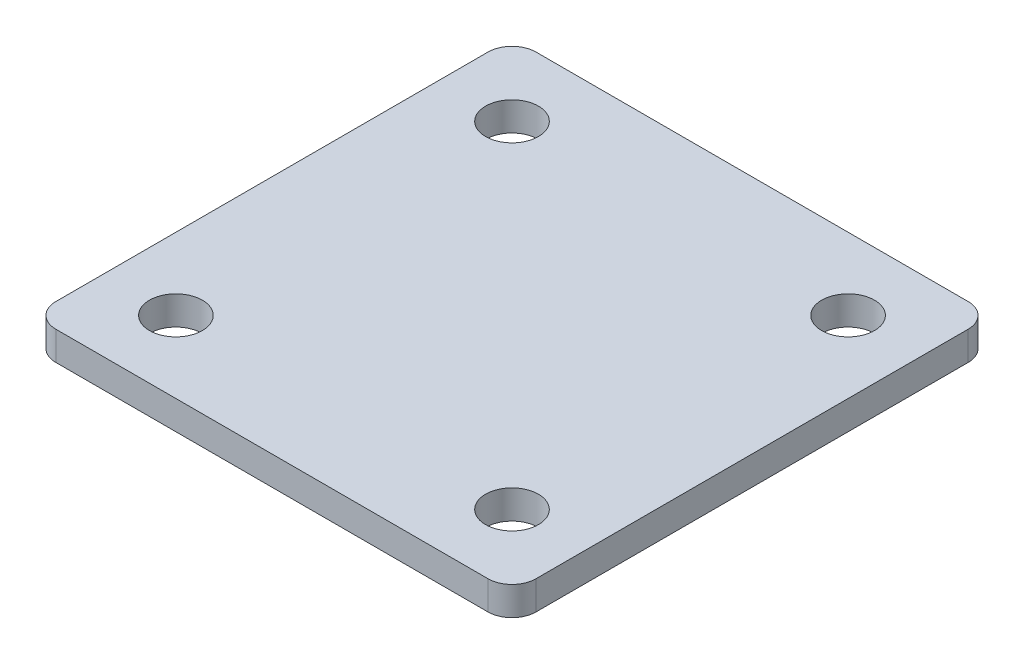
from build123d import *

# Parameters (mm, degrees)
SKETCH1_W                 = 100
SKETCH1_H                 = 100
BOSS_EXTRUDE1_DEPTH       = 6
M10_CLEARANCE_HOLE1_D     = 11
M10_CLEARANCE_HOLE1_DEPTH = 19.75
M10_CLEARANCE_HOLE1_TIP   = 3.304733405
FILLET1_R                 = 5


with BuildPart() as part:
    # Sketch1 → Boss-Extrude1 (new body)
    with BuildSketch(Plane(origin=(0, 0, 0), x_dir=(1, 0, 0), z_dir=(0, 1, 0))):
        Rectangle(SKETCH1_W, SKETCH1_H)
    extrude(amount=BOSS_EXTRUDE1_DEPTH)

    # M10 Clearance Hole1
    with Locations(Plane(origin=(-35, 6, -35), x_dir=(0, 0, 1), z_dir=(0, 1, 0))):
        with Locations((0, 0), (0, 70), (70, 70), (70, 0)):
            Hole(M10_CLEARANCE_HOLE1_D / 2, depth=M10_CLEARANCE_HOLE1_DEPTH)
            with Locations((0, 0, -(M10_CLEARANCE_HOLE1_DEPTH + M10_CLEARANCE_HOLE1_TIP / 2))):  # 118° drill point
                Cone(0, M10_CLEARANCE_HOLE1_D / 2, M10_CLEARANCE_HOLE1_TIP, mode=Mode.SUBTRACT)

    # Fillet1
    fillet1_edges = [part.edges().sort_by_distance(p)[0] for p in [
        (50, 3, 50),
        (-50, 3, 50),
        (-50, 3, -50),
        (50, 3, -50),
    ]]
    fillet(fillet1_edges, radius=FILLET1_R)


solid = part.part
